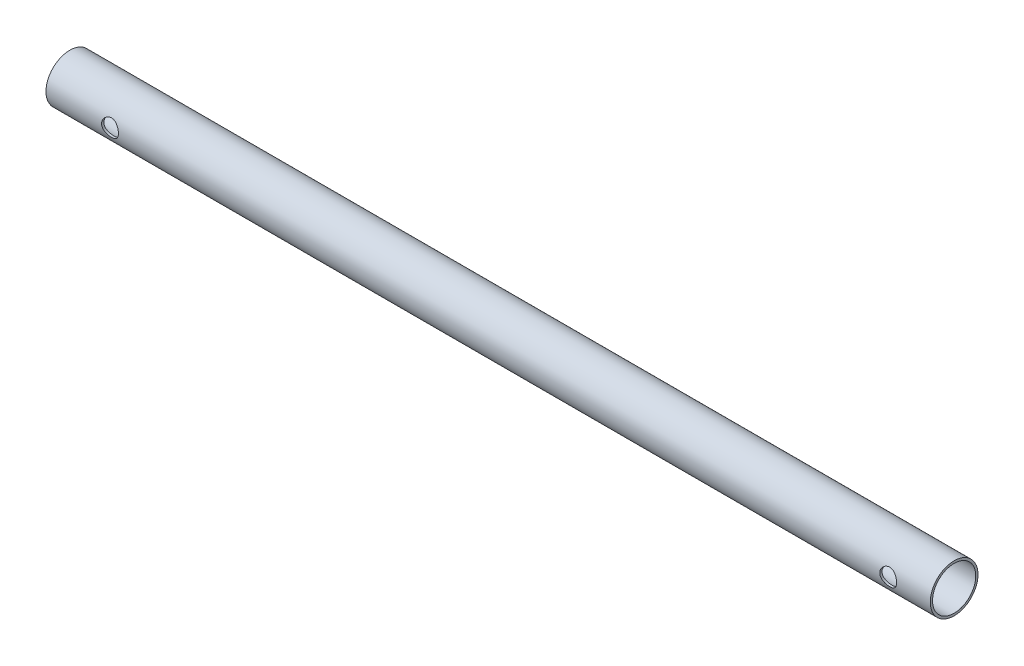
from build123d import *

# Parameters (mm, degrees)
SKETCH1_R               = 8.5
SKETCH1_R_2             = 7.7
BOSS_EXTRUDE1_DEPTH     = 315
CUT_EXTRUDE1_DEPTH      = 320
CUT_EXTRUDE1_DEPTH_BACK = 320
SKETCH2_R               = 3


with BuildPart() as part:
    # Sketch1 → Boss-Extrude1 (new body)
    with BuildSketch(Plane(origin=(0, 0, 0), x_dir=(0, 0, -1), z_dir=(1, 0, 0))):
        Circle(SKETCH1_R)
        Circle(SKETCH1_R_2, mode=Mode.SUBTRACT)
    extrude(amount=BOSS_EXTRUDE1_DEPTH)

    # Sketch2 → Cut-Extrude1 (cut, two sides: drawn at the far end of the back side and taken through both)
    with BuildSketch(Plane.XY.offset(-CUT_EXTRUDE1_DEPTH_BACK)):
        with Locations((22.8, 0)):
            Circle(SKETCH2_R)
        with Locations((300, 0)):
            Circle(SKETCH2_R)
    extrude(amount=CUT_EXTRUDE1_DEPTH + CUT_EXTRUDE1_DEPTH_BACK, mode=Mode.SUBTRACT)


solid = part.part
